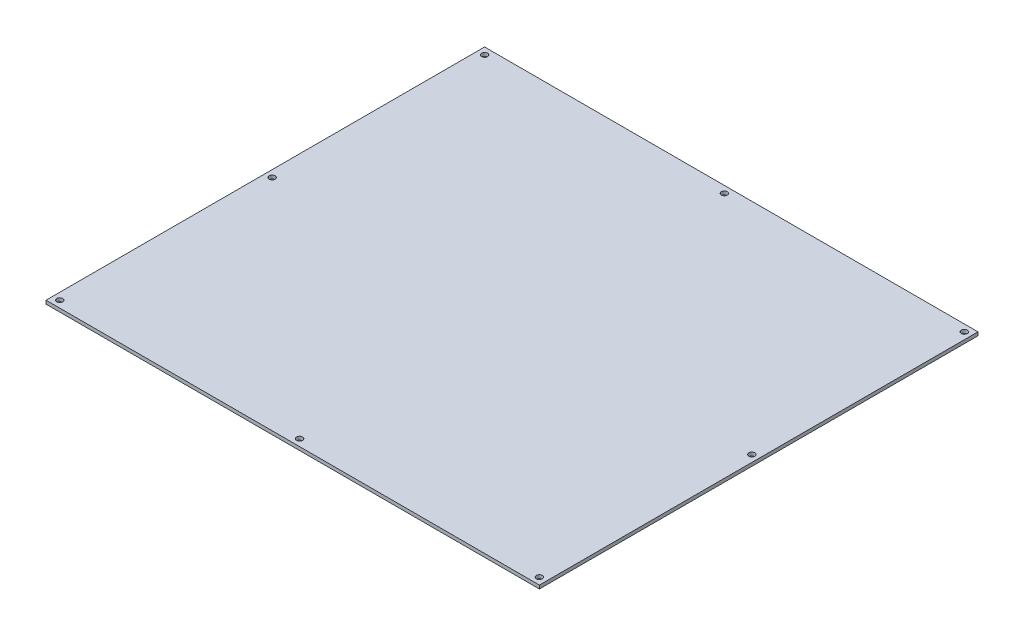
from build123d import *

# Parameters (mm, degrees)
SKETCH1_W           = 228.6
SKETCH1_H           = 203.2
BOSS_EXTRUDE1_DEPTH = 1.5875
SKETCH2_R           = 1.397
CUT_EXTRUDE1_DEPTH  = 306.860622108


with BuildPart() as part:
    # Sketch1 → Boss-Extrude1 (new body)
    with BuildSketch(Plane(origin=(0, 0, 0), x_dir=(1, 0, 0), z_dir=(0, 1, 0))):
        with Locations((114.3, 101.6)):
            Rectangle(SKETCH1_W, SKETCH1_H)
    extrude(amount=BOSS_EXTRUDE1_DEPTH)

    # Sketch2 → Cut-Extrude1 (cut, through all)
    with BuildSketch(Plane(origin=(0, 1.5875, 0), x_dir=(1, 0, 0), z_dir=(0, 1, 0))):
        with Locations(Location((3.175, 200.025, 0), (0, 0, 270))):
            Circle(SKETCH2_R)
        with Locations(Location((114.3, 200.025, 0), (0, 0, 270))):
            Circle(SKETCH2_R)
        with Locations(Location((225.425, 200.025, 0), (0, 0, 270))):
            Circle(SKETCH2_R)
        with Locations(Location((3.175, 3.175, 0), (0, 0, 270))):
            Circle(SKETCH2_R)
        with Locations(Location((114.3, 3.175, 0), (0, 0, 270))):
            Circle(SKETCH2_R)
        with Locations(Location((225.425, 3.175, 0), (0, 0, 270))):
            Circle(SKETCH2_R)
        with Locations(Location((3.175, 101.6, 0), (0, 0, 270))):
            Circle(SKETCH2_R)
        with Locations(Location((225.425, 101.6, 0), (0, 0, 270))):
            Circle(SKETCH2_R)
    extrude(amount=-CUT_EXTRUDE1_DEPTH, mode=Mode.SUBTRACT)


solid = part.part
